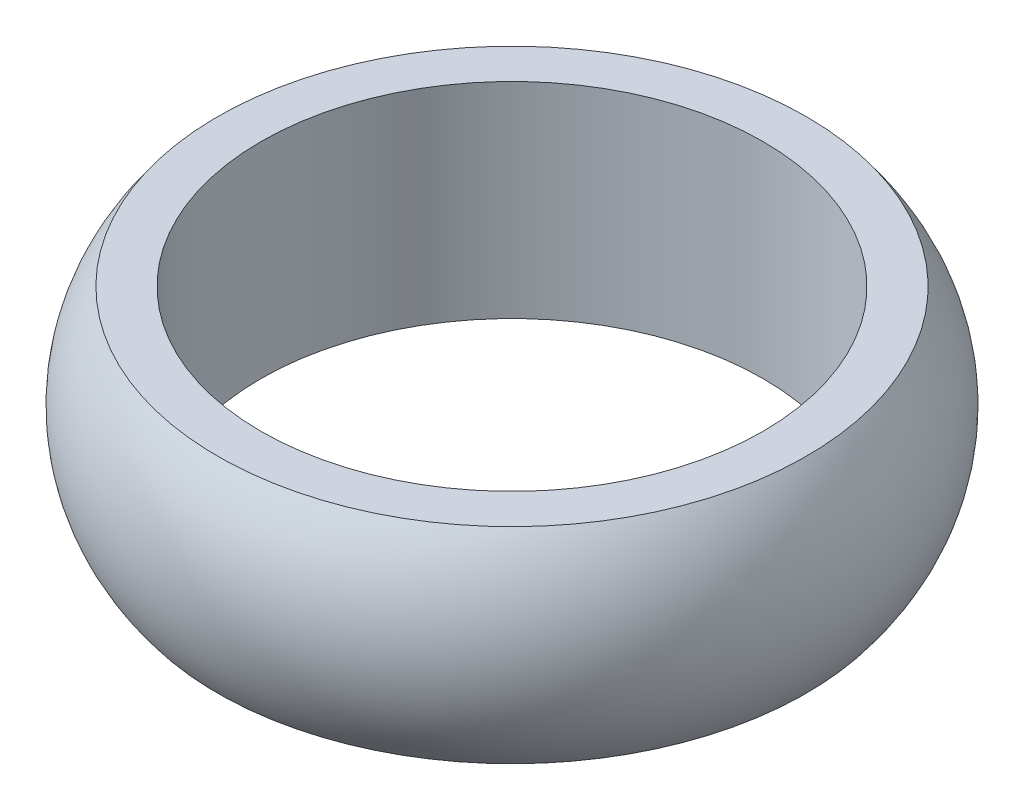
from build123d import *


with BuildPart() as part:
    # Sketch2 → Revolve1 (revolve)
    with BuildSketch(Plane.XY, mode=Mode.PRIVATE) as revolve1_sk:
        with BuildLine():
            Line((11.615, 4.75), (13.615, 4.75))
            ThreePointArc((13.615, 4.75), (15.25, 0), (13.615, -4.75))
            Line((13.615, -4.75), (11.615, -4.75))
            Line((11.615, -4.75), (11.615, 4.75))
        make_face()
    revolve(revolve1_sk.sketch.rotate(Axis((0, 0, 0), (0, 1, 0)), 90), axis=Axis((0, 0, 0), (0, 1, 0)))


solid = part.part
